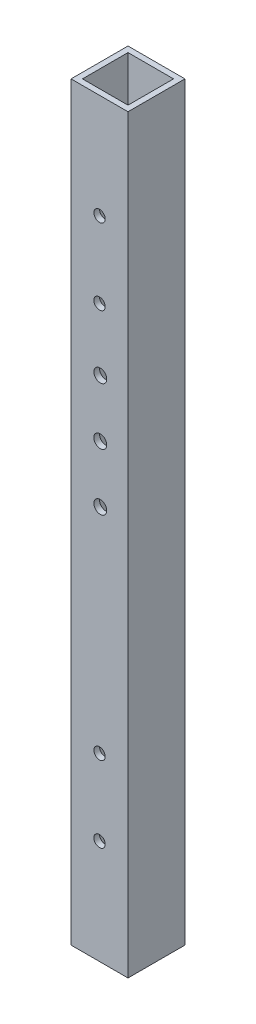
from build123d import *

# Parameters (mm, degrees)
SKETCH_1_W          = 15
SKETCH_1_H          = 15
SKETCH_1_W_2        = 12
SKETCH_1_H_2        = 12
EXTRUDE_1_DEPTH     = 197.65
SKETCH_2_R          = 1.5
SKETCH_2_R_2        = 1.7
CUT_EXTRUDE_1_DEPTH = 199.785116395


with BuildPart() as part:
    # 草图1 → 凸台-拉伸1 (new body)
    with BuildSketch(Plane(origin=(0, 0, 0), x_dir=(1, 0, 0), z_dir=(0, 1, 0))):
        with Locations((7.5, 7.5)):
            Rectangle(SKETCH_1_W, SKETCH_1_H)
        with Locations((7.5, 7.5)):
            Rectangle(SKETCH_1_W_2, SKETCH_1_H_2, mode=Mode.SUBTRACT)
    extrude(amount=EXTRUDE_1_DEPTH)

    # 草图2 (on Front Plane) → 切除-拉伸1 (cut, through all)
    with BuildSketch(Plane.XY):
        with Locations((7.5, 47.5)):
            Circle(SKETCH_2_R)
        with Locations((7.5, 27.5)):
            Circle(SKETCH_2_R)
        with Locations((7.7, 103.825)):
            Circle(SKETCH_2_R_2)
        with Locations((7.7, 118.825)):
            Circle(SKETCH_2_R_2)
        with Locations((7.7, 133.825)):
            Circle(SKETCH_2_R_2)
        with Locations((7.5, 150.15)):
            Circle(SKETCH_2_R)
        with Locations((7.5, 170.15)):
            Circle(SKETCH_2_R)
    extrude(amount=-CUT_EXTRUDE_1_DEPTH, mode=Mode.SUBTRACT)


solid = part.part
